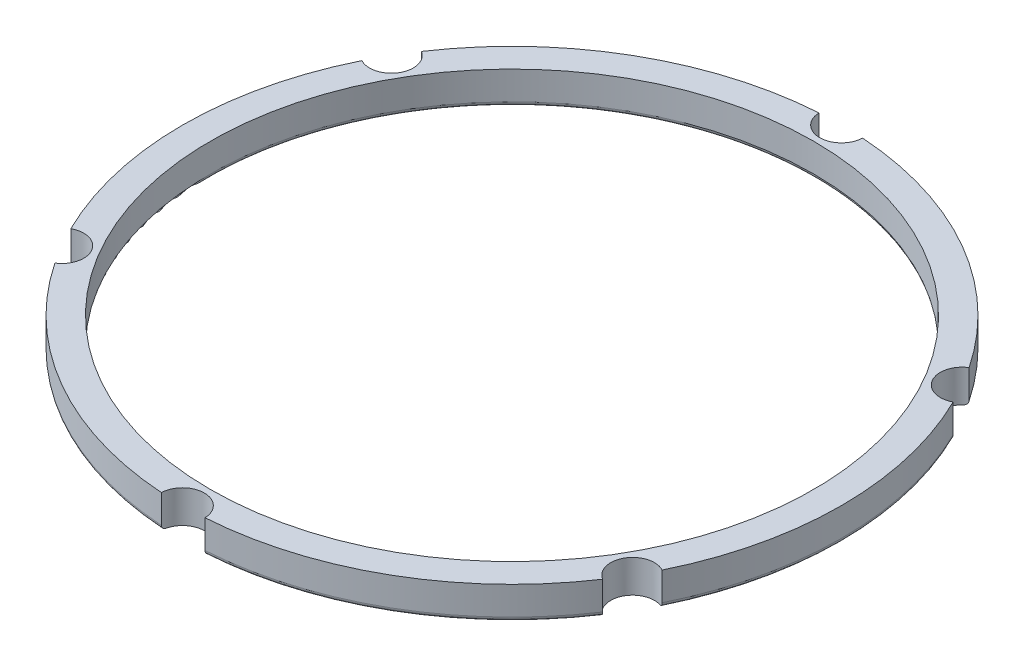
from build123d import *

# Parameters (mm, degrees)
SKETCH_1_R               = 150.987526818
SKETCH_1_R_2             = 138.21111966
EXTRUDE_1_DEPTH          = 15
FILLET_1_R               = 2
SKETCH_2_R               = 10
CUT_EXTRUDE_1_DEPTH      = 15
PATTERN_CIRCULAR_1_COUNT = 6


with BuildPart() as part:
    # Эскиз1 → Бобышка-Вытянуть1 (new body)
    with BuildSketch(Plane(origin=(0, 0, 0), x_dir=(1, 0, 0), z_dir=(0, 1, 0))):
        with Locations(Location((0, 0, 0), (0, 0, 270))):
            Circle(SKETCH_1_R)
        with Locations(Location((0, 0, 0), (0, 0, 270))):
            Circle(SKETCH_1_R_2, mode=Mode.SUBTRACT)
    extrude(amount=EXTRUDE_1_DEPTH)

    # Скругление1
    fillet_1_edges = [part.edges().sort_by_distance(p)[0] for p in [
        (0, 0, -150.987526818),
        (0, 0, -138.21111966),
    ]]
    fillet(fillet_1_edges, radius=FILLET_1_R)

    # Эскиз2 → Вырез-Вытянуть1 (cut)
    with BuildSketch(Plane(origin=(0, 0, 0), x_dir=(1, 0, 0), z_dir=(0, 1, 0))):
        with Locations((0, 150.987526818)):
            Circle(SKETCH_2_R)
    cut_extrude_1 = extrude(amount=CUT_EXTRUDE_1_DEPTH, mode=Mode.SUBTRACT)

    # Круговой массив1: Вырез-Вытянуть1 ×6 about axis
    pattern_circular_1_axis = Axis((0, 0, 0), (0, 1, 0))
    for i in range(1, PATTERN_CIRCULAR_1_COUNT):
        add(cut_extrude_1.rotate(pattern_circular_1_axis, i * 360 / PATTERN_CIRCULAR_1_COUNT), mode=Mode.SUBTRACT)


solid = part.part
